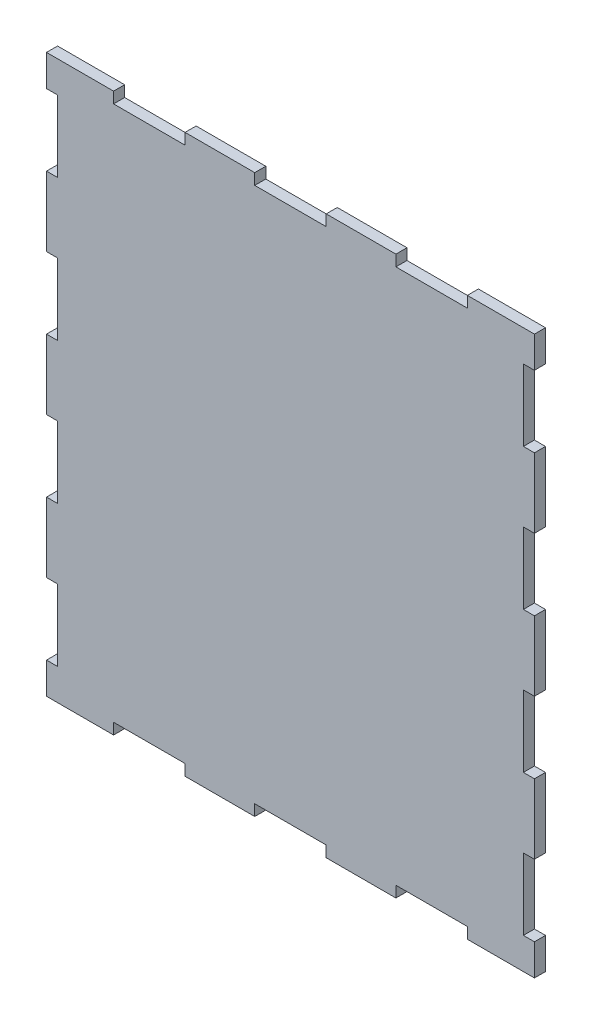
from build123d import *

# Parameters (mm, degrees)
SKETCH1_W           = 140
SKETCH1_H           = 160
BOSS_EXTRUDE1_DEPTH = 3.175
SKETCH2_W           = 3.175
SKETCH2_H           = 20.5
SKETCH2_W_2         = 20.5
SKETCH2_H_2         = 3.175
CUT_EXTRUDE1_DEPTH  = 3.175


with BuildPart() as part:
    # Sketch1 → Boss-Extrude1 (new body)
    with BuildSketch(Plane.XY):
        with Locations((5.981871877, 80)):
            Rectangle(SKETCH1_W, SKETCH1_H)
    extrude(amount=BOSS_EXTRUDE1_DEPTH)

    # Sketch2 → Cut-Extrude1 (cut)
    with BuildSketch(Plane.XY.offset(3.175)):
        with Locations((-62.430628123, 19.25)):
            Rectangle(SKETCH2_W, SKETCH2_H)
        with Locations((-62.430628123, 59.75)):
            Rectangle(SKETCH2_W, SKETCH2_H)
        with Locations((-62.430628123, 100.25)):
            Rectangle(SKETCH2_W, SKETCH2_H)
        with Locations((-62.430628123, 140.75)):
            Rectangle(SKETCH2_W, SKETCH2_H)
        with Locations((-34.518128123, 158.4125)):
            Rectangle(SKETCH2_W_2, SKETCH2_H_2)
        with Locations((5.981871877, 158.4125)):
            Rectangle(SKETCH2_W_2, SKETCH2_H_2)
        with Locations((46.481871877, 158.4125)):
            Rectangle(SKETCH2_W_2, SKETCH2_H_2)
        with Locations((74.394371877, 140.75)):
            Rectangle(SKETCH2_W, SKETCH2_H)
        with Locations((74.394371877, 100.25)):
            Rectangle(SKETCH2_W, SKETCH2_H)
        with Locations((74.394371877, 59.75)):
            Rectangle(SKETCH2_W, SKETCH2_H)
        with Locations((74.394371877, 19.25)):
            Rectangle(SKETCH2_W, SKETCH2_H)
        with Locations((46.481871877, 1.5875)):
            Rectangle(SKETCH2_W_2, SKETCH2_H_2)
        with Locations((5.981871877, 1.5875)):
            Rectangle(SKETCH2_W_2, SKETCH2_H_2)
        with Locations((-34.518128123, 1.5875)):
            Rectangle(SKETCH2_W_2, SKETCH2_H_2)
    extrude(amount=-CUT_EXTRUDE1_DEPTH, mode=Mode.SUBTRACT)


solid = part.part
